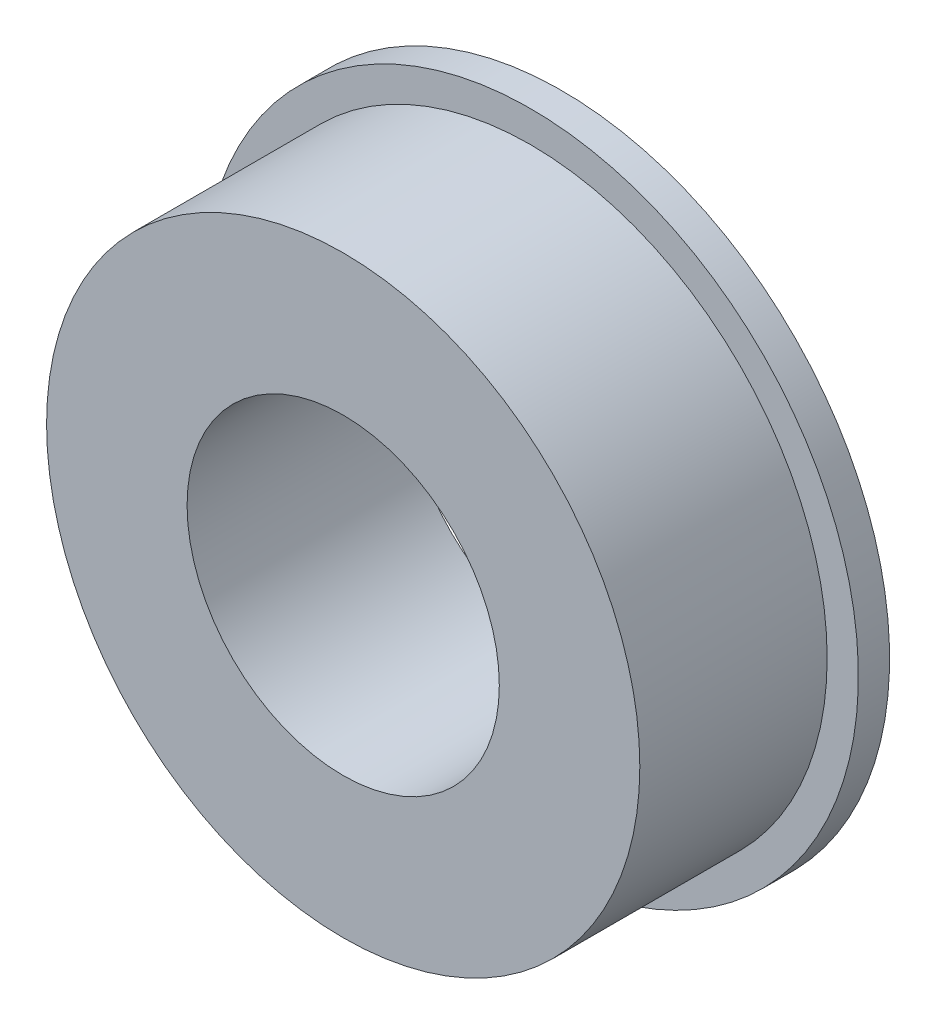
from build123d import *

# Parameters (mm, degrees)
SKETCH_1_R      = 9.5
SKETCH_1_R_2    = 5
EXTRUDE_1_DEPTH = 7
SKETCH_2_R      = 10.5
SKETCH_2_R_2    = 9.5
EXTRUDE_2_DEPTH = 1


with BuildPart() as part:
    # 草图1 → 凸台-拉伸1 (new body)
    with BuildSketch(Plane.XY):
        Circle(SKETCH_1_R)
        Circle(SKETCH_1_R_2, mode=Mode.SUBTRACT)
    extrude(amount=EXTRUDE_1_DEPTH)

    # 草图2 → 凸台-拉伸2 (add)
    with BuildSketch(Plane(origin=(0, 0, 0), x_dir=(-1, 0, 0), z_dir=(0, 0, -1))):
        Circle(SKETCH_2_R)
        Circle(SKETCH_2_R_2, mode=Mode.SUBTRACT)
    extrude(amount=-EXTRUDE_2_DEPTH)


solid = part.part
